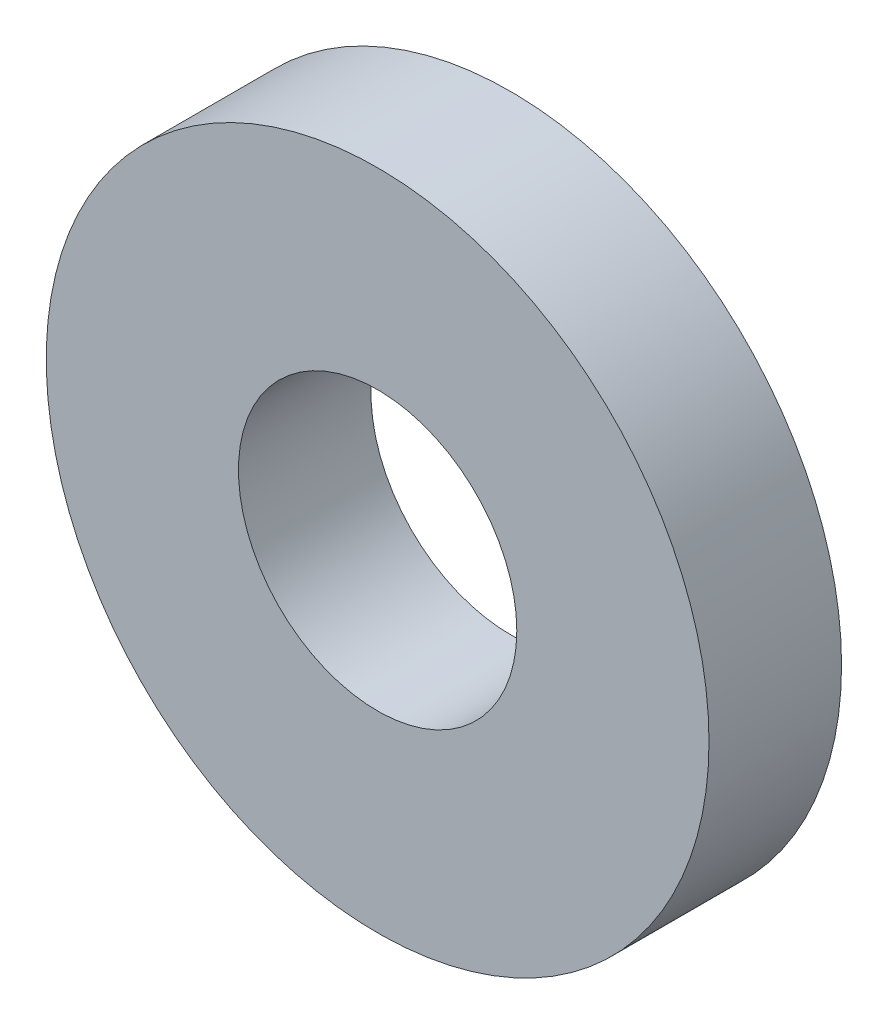
from build123d import *

# Parameters (mm, degrees)
SKETCH_1_R      = 5
SKETCH_1_R_2    = 2.1
EXTRUDE_1_DEPTH = 2


with BuildPart() as part:
    # 草图1 → 凸台-拉伸1 (new body)
    with BuildSketch(Plane.XY):
        Circle(SKETCH_1_R)
        Circle(SKETCH_1_R_2, mode=Mode.SUBTRACT)
    extrude(amount=EXTRUDE_1_DEPTH)


solid = part.part
